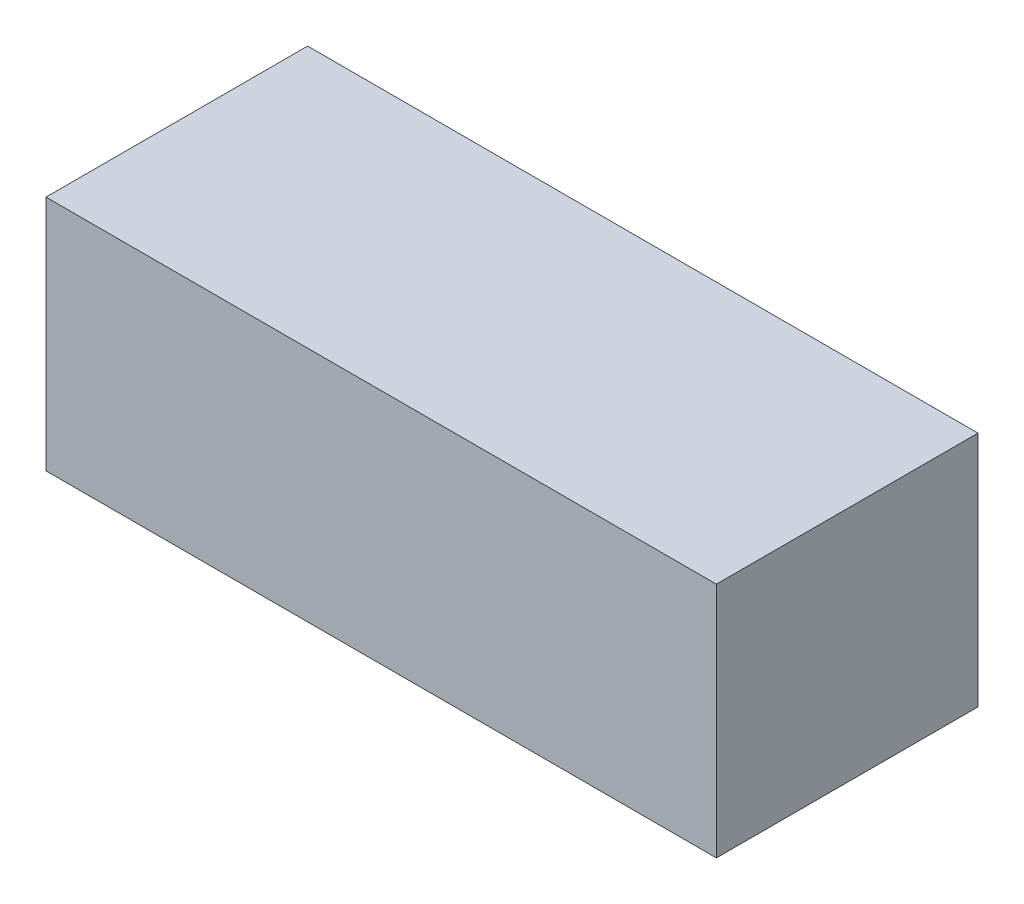
from build123d import *

# Parameters (mm, degrees)
BOSS_EXTRUDE1_DEPTH      = 80
BOSS_EXTRUDE1_DEPTH_BACK = 80
SKETCH1_W                = 410
SKETCH1_H                = 145


with BuildPart() as part:
    # Sketch1 → Boss-Extrude1 (new, two sides: drawn at the far end of the back side and taken through both)
    with BuildSketch(Plane.XY.offset(-BOSS_EXTRUDE1_DEPTH_BACK)):
        with Locations((-50, 0)):
            Rectangle(SKETCH1_W, SKETCH1_H)
    extrude(amount=BOSS_EXTRUDE1_DEPTH + BOSS_EXTRUDE1_DEPTH_BACK)


solid = part.part
